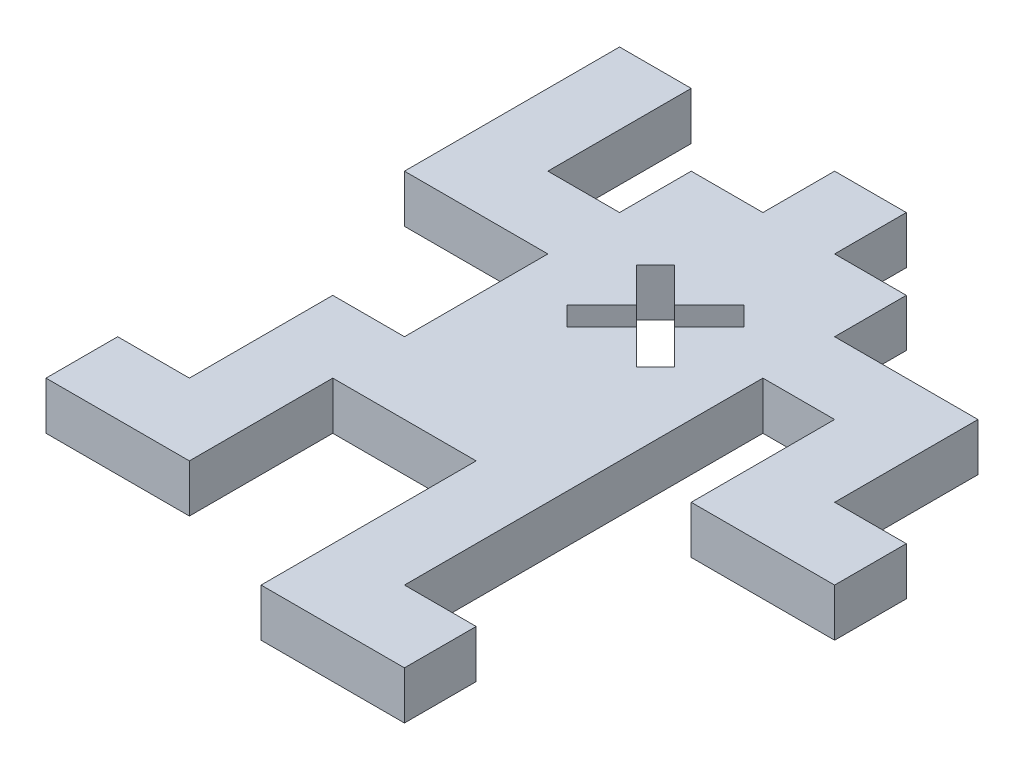
from build123d import *

# Parameters (mm, degrees)
SKETCH1_W           = 22.5
SKETCH1_H           = 37.5
SKETCH1_W_2         = 7.5
SKETCH1_H_2         = 7.5
BOSS_EXTRUDE1_DEPTH = 5
CUT_EXTRUDE1_DEPTH  = 54.531532763


with BuildPart() as part:
    # Sketch1 → Boss-Extrude1 (new body)
    with BuildSketch(Plane(origin=(0, 0, 0), x_dir=(1, 0, 0), z_dir=(0, 1, 0))):
        Polygon((-11.25, 3.75), (-11.25, 11.25), (-18.75, 11.25), (-18.75, 26.25), (-26.25, 26.25), (-26.25, 3.75), align=None)
        Rectangle(SKETCH1_W, SKETCH1_H)
        with Locations((0, 22.5)):
            Rectangle(SKETCH1_W_2, SKETCH1_H_2)
        Polygon((26.25, 11.25), (11.25, 11.25), (11.25, 3.75), (18.75, 3.75), (18.75, -11.25), (33.75, -11.25), (33.75, -3.75), (26.25, -3.75), align=None)
        Polygon((11.25, -18.75), (3.75, -18.75), (3.75, -41.25), (18.75, -41.25), (18.75, -33.75), (11.25, -33.75), align=None)
        Polygon((-11.25, -18.75), (-11.25, -11.25), (-18.75, -11.25), (-18.75, -26.25), (-26.25, -26.25), (-26.25, -33.75), (-11.25, -33.75), align=None)
    extrude(amount=BOSS_EXTRUDE1_DEPTH)

    # Sketch2 → Cut-Extrude1 (cut, through all)
    with BuildSketch(Plane(origin=(0, 5, 0), x_dir=(1, 0, 0), z_dir=(0, 1, 0))):
        Polygon((0, 5.75), (-3.625, 9.375), (-5.625, 7.375), (-2, 3.75), (-5.625, 0.125), (-3.625, -1.875), (0, 1.75), (3.625, -1.875), (5.625, 0.125), (2, 3.75), (5.625, 7.375), (3.625, 9.375), align=None)
    extrude(amount=-CUT_EXTRUDE1_DEPTH, mode=Mode.SUBTRACT)


solid = part.part
